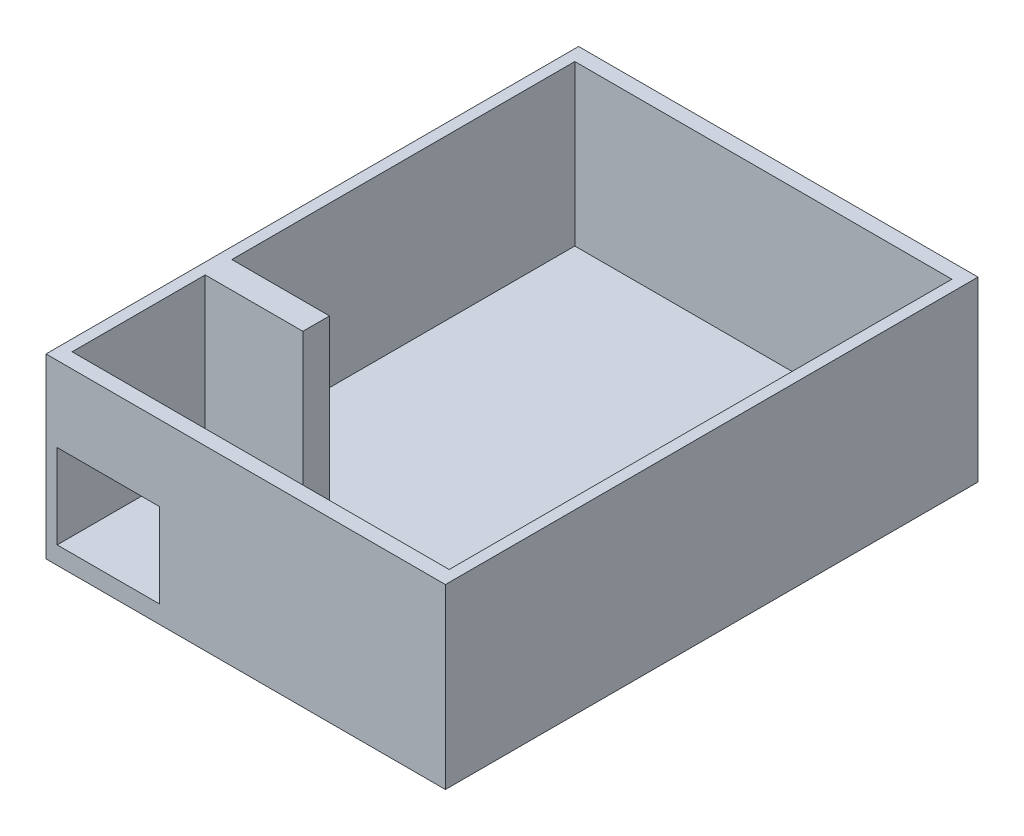
from build123d import *

# Parameters (mm, degrees)
IZIM1_W                     = 45
IZIM1_H                     = 60
Y_KSEKLIK_EKSTR_ZYON1_DEPTH = 2
IZIM2_W                     = 45
IZIM2_H                     = 60
IZIM2_W_2                   = 42.48
IZIM2_H_2                   = 56.64
Y_KSEKLIK_EKSTR_ZYON2_DEPTH = 18
IZIM6_W                     = 11.5
IZIM6_H                     = 9.5
KES_EKSTR_ZYON2_DEPTH       = 18
IZIM7_W                     = 11
IZIM7_H                     = 3
Y_KSEKLIK_EKSTR_ZYON3_DEPTH = 18


with BuildPart() as part:
    # Çizim1 → Yükseklik-Ekstrüzyon1 (new body)
    with BuildSketch(Plane(origin=(0, 0, 0), x_dir=(1, 0, 0), z_dir=(0, 1, 0))):
        Rectangle(IZIM1_W, IZIM1_H)
    extrude(amount=Y_KSEKLIK_EKSTR_ZYON1_DEPTH)

    # Çizim2 → Yükseklik-Ekstrüzyon2 (add)
    with BuildSketch(Plane(origin=(0, 2, 0), x_dir=(1, 0, 0), z_dir=(0, 1, 0))):
        Rectangle(IZIM2_W, IZIM2_H)
        Rectangle(IZIM2_W_2, IZIM2_H_2, mode=Mode.SUBTRACT)
    extrude(amount=Y_KSEKLIK_EKSTR_ZYON2_DEPTH)

    # Çizim6 → Kes-Ekstrüzyon2 (cut)
    with BuildSketch(Plane.XY.offset(30)):
        with Locations((-15.49, 6.75)):
            Rectangle(IZIM6_W, IZIM6_H)
    extrude(amount=-KES_EKSTR_ZYON2_DEPTH, mode=Mode.SUBTRACT)

    # Çizim7 → Yükseklik-Ekstrüzyon3 (add)
    with BuildSketch(Plane(origin=(0, 2, 0), x_dir=(1, 0, 0), z_dir=(0, 1, 0))):
        with Locations((-15.74, -11.82)):
            Rectangle(IZIM7_W, IZIM7_H)
    extrude(amount=Y_KSEKLIK_EKSTR_ZYON3_DEPTH)


solid = part.part
